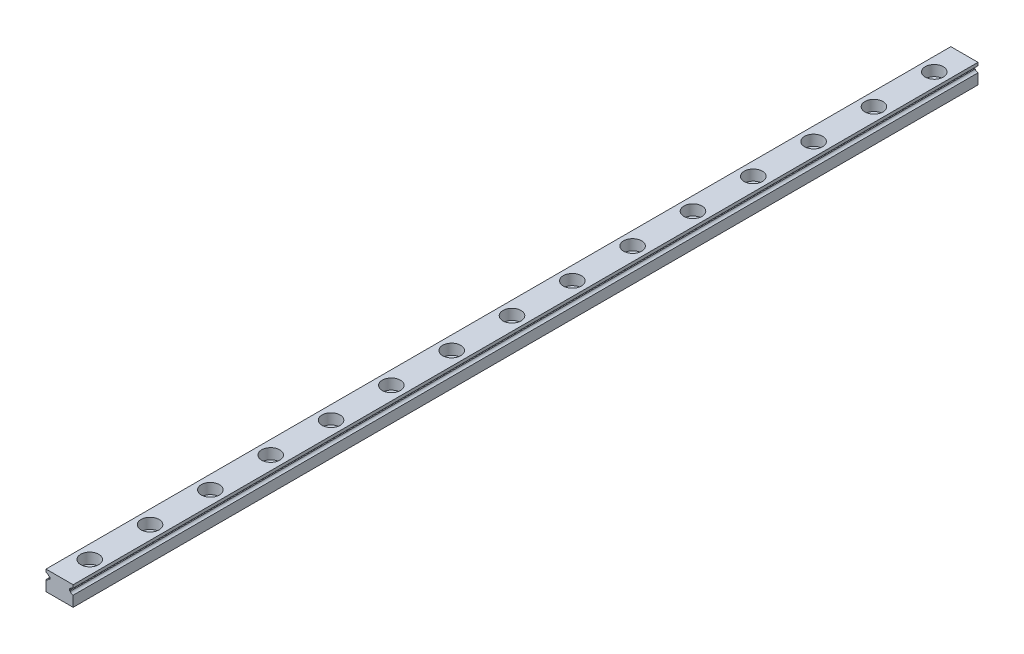
from build123d import *

# Parameters (mm, degrees)
EXTRUDE1_DEPTH  = 300
SKETCH2_R       = 3
EXTRUDE2_DEPTH  = 3.5
SKETCH_R        = 1.75
EXTRUDE3_DEPTH  = 301.104148588
LPATTERN1_COUNT = 16
LPATTERN1_PITCH = 20


with BuildPart() as part:
    # Sketch1 → Extrude1 (new body)
    with BuildSketch(Plane.XY):
        with BuildLine():
            Line((-4.5, -3.25), (4.5, -3.25))
            Line((4.5, -3.25), (4.5, 0.25))
            ThreePointArc((4.5, 0.25), (3.93077967, 0.427814974), (3.563991137, 0.898023568))
            Line((3.563991137, 0.898023568), (3.235073025, 0.898023568))
            Line((3.235073025, 0.898023568), (3.235073025, 1.601976432))
            Line((3.235073025, 1.601976432), (3.563991137, 1.601976432))
            ThreePointArc((3.563991137, 1.601976432), (3.93077967, 2.072185026), (4.5, 2.25))
            Line((4.5, 2.25), (4.5, 3.25))
            Line((4.5, 3.25), (-4.5, 3.25))
            Line((-4.5, 3.25), (-4.5, 2.25))
            ThreePointArc((-4.5, 2.25), (-3.93077967, 2.072185026), (-3.563991137, 1.601976432))
            Line((-3.563991137, 1.601976432), (-3.235073025, 1.601976432))
            Line((-3.235073025, 1.601976432), (-3.235073025, 0.898023568))
            Line((-3.235073025, 0.898023568), (-3.563991137, 0.898023568))
            ThreePointArc((-3.563991137, 0.898023568), (-3.93077967, 0.427814974), (-4.5, 0.25))
            Line((-4.5, 0.25), (-4.5, -3.25))
        make_face()
    extrude(amount=EXTRUDE1_DEPTH)

    # Sketch2 → Extrude2 (cut)
    with BuildSketch(Plane(origin=(0, 3.25, 0), x_dir=(1, 0, 0), z_dir=(0, 1, 0))):
        with Locations((0, -10)):
            Circle(SKETCH2_R)
    extrude2 = extrude(amount=-EXTRUDE2_DEPTH, mode=Mode.SUBTRACT)

    # Sketch → Extrude3 (cut, through all)
    with BuildSketch(Plane(origin=(0, 3.25, 0), x_dir=(1, 0, 0), z_dir=(0, 1, 0))):
        with Locations((0, -10)):
            Circle(SKETCH_R)
    extrude3 = extrude(amount=-EXTRUDE3_DEPTH, mode=Mode.SUBTRACT)

    # LPattern1: Extrude2, Extrude3 ×16
    with Locations(*[(0, 0, i * LPATTERN1_PITCH) for i in range(1, LPATTERN1_COUNT)]):
        add(extrude2, mode=Mode.SUBTRACT)
        add(extrude3, mode=Mode.SUBTRACT)


solid = part.part
